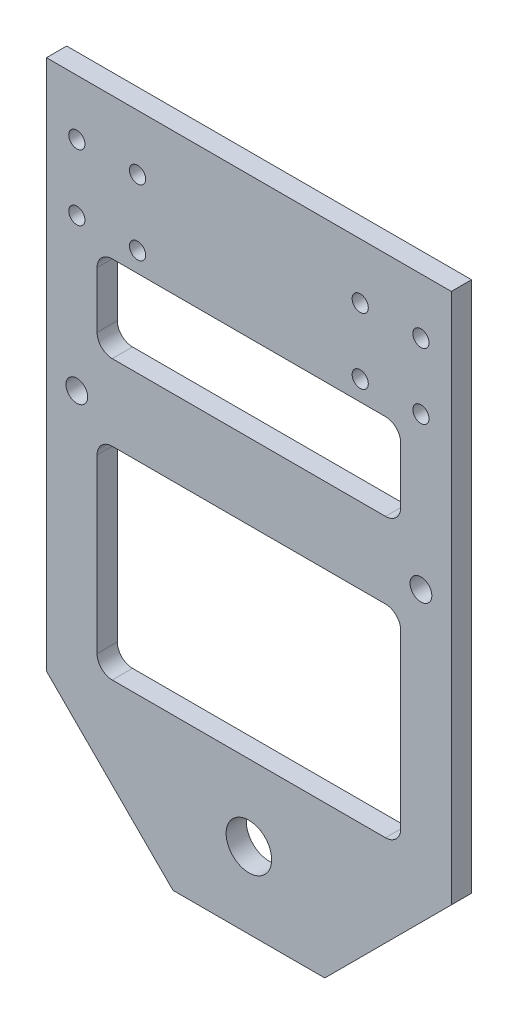
from build123d import *

# Parameters (mm, degrees)
SKETCH_1_W          = 80
SKETCH_1_H          = 130
SKETCH_1_R          = 4.5
EXTRUDE_1_DEPTH     = 4
CHAMFER_1_SIZE      = 25
CUT_EXTRUDE_1_DEPTH = 5
SKETCH_4_R          = 2.15
CUT_EXTRUDE_2_DEPTH = 4
SKETCH_5_R          = 1.6
CUT_EXTRUDE_3_DEPTH = 4


with BuildPart() as part:
    # 草图1 → 凸台-拉伸1 (new body)
    with BuildSketch(Plane.XY):
        with Locations((0, 21)):
            Rectangle(SKETCH_1_W, SKETCH_1_H)
        with Locations((0, -29)):
            Circle(SKETCH_1_R, mode=Mode.SUBTRACT)
    extrude(amount=-EXTRUDE_1_DEPTH)

    # 倒角1
    chamfer_1_edges = [part.edges().sort_by_distance(p)[0] for p in [
        (40, -44, -2),
        (-40, -44, -2),
    ]]
    chamfer(chamfer_1_edges, length=CHAMFER_1_SIZE)

    # 草图3 → 切除-拉伸1 (cut)
    with BuildSketch(Plane(origin=(0, 0, -4), x_dir=(-1, 0, 0), z_dir=(0, 0, -1))):
        with BuildLine():
            ThreePointArc((-27, 58.07), (-29.121320344, 57.191320344), (-30, 55.07))
            Line((-30, 55.07), (-30, 44))
            ThreePointArc((-30, 44), (-29.121320344, 41.878679656), (-27, 41))
            Line((-27, 41), (27, 41))
            ThreePointArc((27, 41), (29.121320344, 41.878679656), (30, 44))
            Line((30, 44), (30, 55.07))
            ThreePointArc((30, 55.07), (29.121320344, 57.191320344), (27, 58.07))
            Line((27, 58.07), (-17.606738259, 58.07))
            Line((-17.606738259, 58.07), (-27, 58.07))
        make_face()
        with BuildLine():
            Line((-27, 26), (27, 26))
            ThreePointArc((27, 26), (29.121320344, 25.121320344), (30, 23))
            Line((30, 23), (30, -11))
            ThreePointArc((30, -11), (29.121320344, -13.121320344), (27, -14))
            Line((27, -14), (-27, -14))
            ThreePointArc((-27, -14), (-29.121320344, -13.121320344), (-30, -11))
            Line((-30, -11), (-30, 23))
            ThreePointArc((-30, 23), (-29.121320344, 25.121320344), (-27, 26))
        make_face()
    extrude(amount=-CUT_EXTRUDE_1_DEPTH, mode=Mode.SUBTRACT)

    # 草图4 → 切除-拉伸2 (cut)
    with BuildSketch(Plane(origin=(0, 0, -4), x_dir=(-1, 0, 0), z_dir=(0, 0, -1))):
        with Locations((-34, 32)):
            Circle(SKETCH_4_R)
        with Locations((34, 32)):
            Circle(SKETCH_4_R)
    extrude(amount=-CUT_EXTRUDE_2_DEPTH, mode=Mode.SUBTRACT)

    # 草图5 → 切除-拉伸3 (cut)
    with BuildSketch(Plane(origin=(0, 0, -4), x_dir=(-1, 0, 0), z_dir=(0, 0, -1))):
        with Locations((34, 75)):
            Circle(SKETCH_5_R)
        with Locations((22, 75)):
            Circle(SKETCH_5_R)
        with Locations((-22, 75)):
            Circle(SKETCH_5_R)
        with Locations((-34, 75)):
            Circle(SKETCH_5_R)
        with Locations((34, 62)):
            Circle(SKETCH_5_R)
        with Locations((22, 62)):
            Circle(SKETCH_5_R)
        with Locations((-22, 62)):
            Circle(SKETCH_5_R)
        with Locations((-34, 62)):
            Circle(SKETCH_5_R)
    extrude(amount=-CUT_EXTRUDE_3_DEPTH, mode=Mode.SUBTRACT)


solid = part.part
